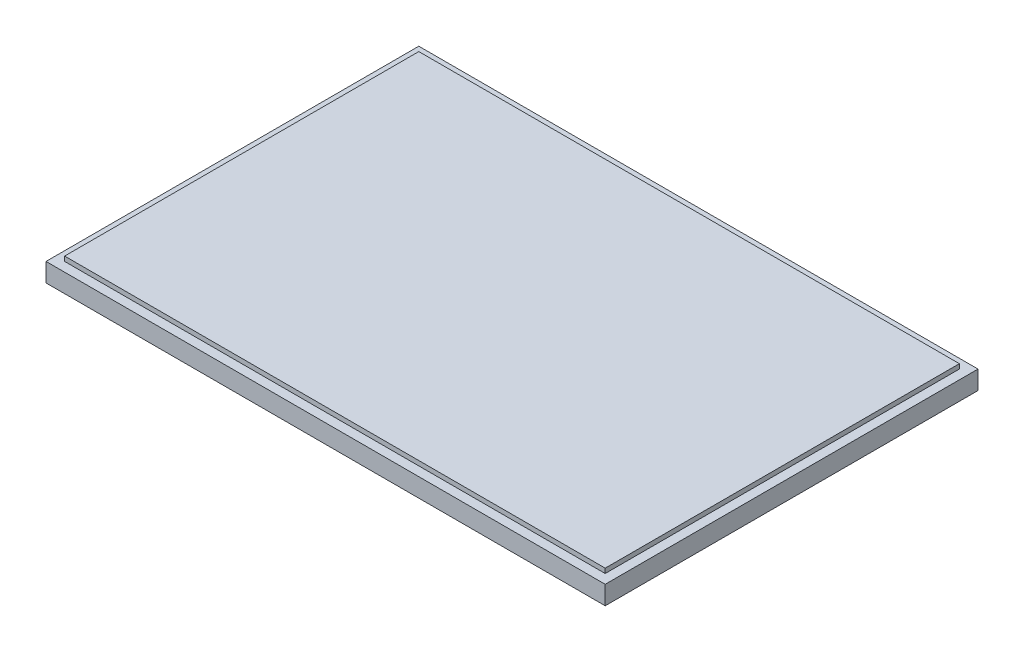
from build123d import *

# Parameters (mm, degrees)
CROQUIS1_W              = 60
CROQUIS1_H              = 40
SALIENTE_EXTRUIR1_DEPTH = 2
CROQUIS2_W              = 58
CROQUIS2_H              = 38
SALIENTE_EXTRUIR2_DEPTH = 0.5


with BuildPart() as part:
    # Croquis1 → Saliente-Extruir1 (new body)
    with BuildSketch(Plane(origin=(0, 0, 0), x_dir=(1, 0, 0), z_dir=(0, 1, 0))):
        Rectangle(CROQUIS1_W, CROQUIS1_H)
    extrude(amount=SALIENTE_EXTRUIR1_DEPTH)

    # Croquis2 → Saliente-Extruir2 (add)
    with BuildSketch(Plane(origin=(0, 2, 0), x_dir=(1, 0, 0), z_dir=(0, 1, 0))):
        Rectangle(CROQUIS2_W, CROQUIS2_H)
    extrude(amount=SALIENTE_EXTRUIR2_DEPTH)


solid = part.part
